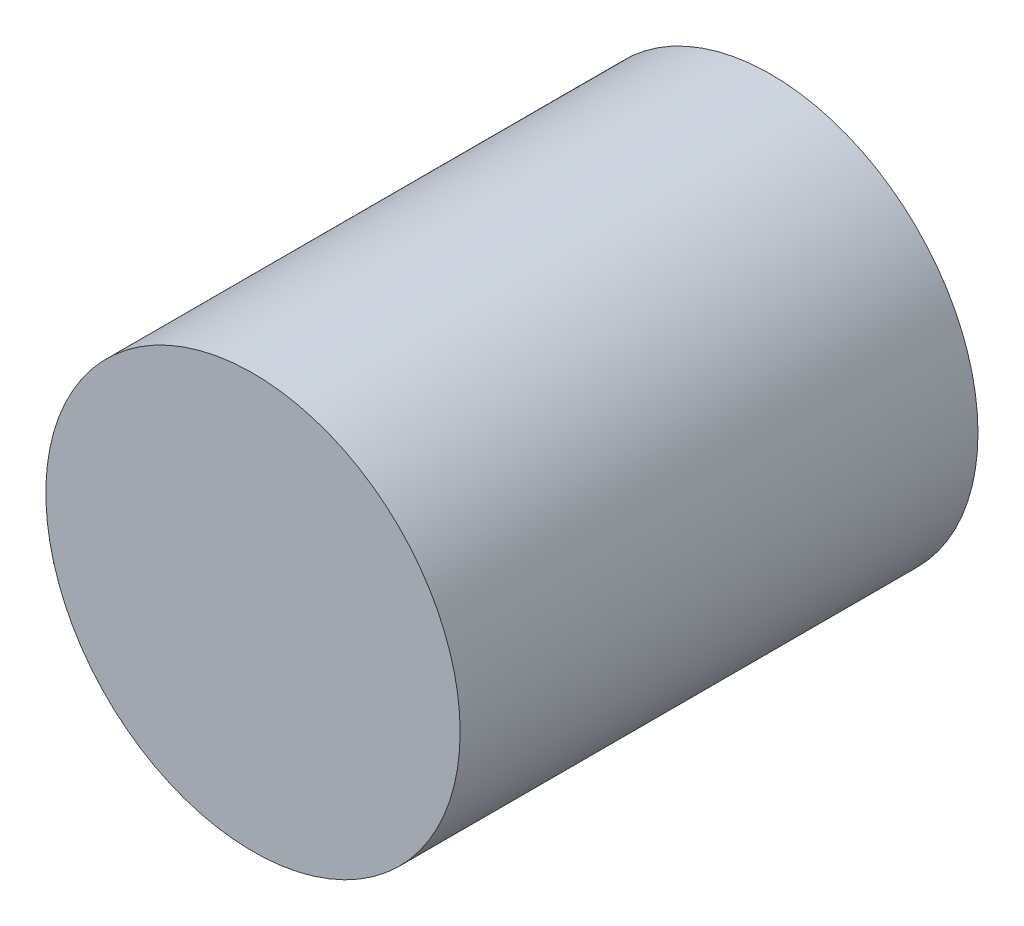
from build123d import *

# Parameters (mm, degrees)
SKETCH1_R           = 80
BOSS_EXTRUDE1_DEPTH = 200
SKETCH2_R           = 44
BOSS_EXTRUDE2_DEPTH = 14
SKETCH3_R           = 30
BOSS_EXTRUDE3_DEPTH = 7
SKETCH4_R           = 21.5
CUT_EXTRUDE1_DEPTH  = 7


with BuildPart() as part:
    # Sketch1 → Boss-Extrude1 (new body)
    with BuildSketch(Plane.XY):
        Circle(SKETCH1_R)
    extrude(amount=BOSS_EXTRUDE1_DEPTH)

    # Sketch2 → Boss-Extrude2 (add)
    with BuildSketch(Plane(origin=(0, 0, 0), x_dir=(-1, 0, 0), z_dir=(0, 0, -1))):
        Circle(SKETCH2_R)
    extrude(amount=BOSS_EXTRUDE2_DEPTH)

    # Sketch3 → Boss-Extrude3 (add)
    with BuildSketch(Plane(origin=(0, 0, -14), x_dir=(-1, 0, 0), z_dir=(0, 0, -1))):
        Circle(SKETCH3_R)
    extrude(amount=BOSS_EXTRUDE3_DEPTH)

    # Sketch4 → Cut-Extrude1 (cut)
    with BuildSketch(Plane(origin=(0, 0, -21), x_dir=(-1, 0, 0), z_dir=(0, 0, -1))):
        Circle(SKETCH4_R)
    extrude(amount=-CUT_EXTRUDE1_DEPTH, mode=Mode.SUBTRACT)


solid = part.part
